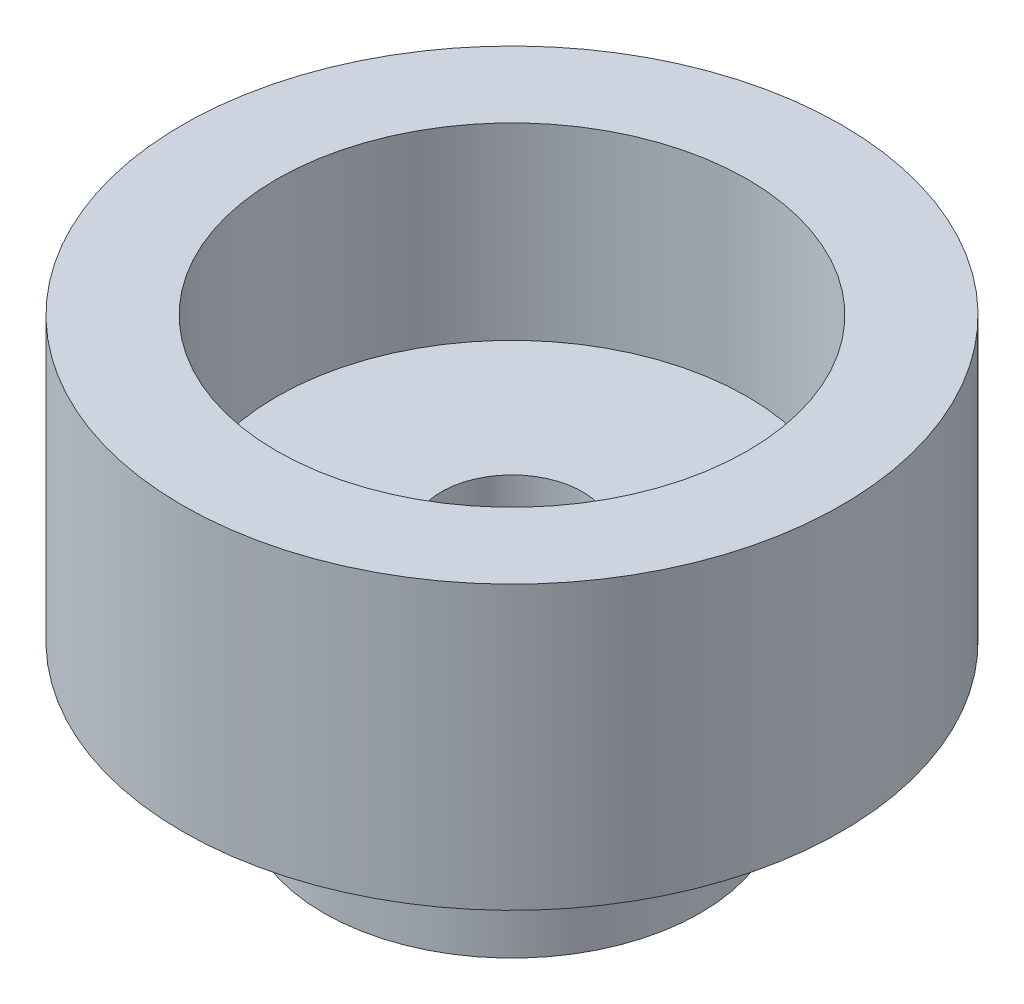
from build123d import *

# Parameters (mm, degrees)
SKETCH1_R           = 1.5
SKETCH1_R_2         = 0.75
BOSS_EXTRUDE1_DEPTH = 2.5
SKETCH2_R           = 3.5
SKETCH2_R_2         = 2.5
BOSS_EXTRUDE2_DEPTH = 2
BOSS_EXTRUDE3_START = 1
SKETCH3_R           = 3.5
SKETCH3_R_2         = 0.75
BOSS_EXTRUDE3_DEPTH = 1
SKETCH4_R           = 2
SKETCH4_R_2         = 0.75
BOSS_EXTRUDE4_DEPTH = 2


with BuildPart() as part:
    # Sketch1 → Boss-Extrude1 (new body)
    with BuildSketch(Plane(origin=(0, 0, 0), x_dir=(1, 0, 0), z_dir=(0, 1, 0))):
        with Locations(Location((0, 0, 0), (0, 0, 270))):
            Circle(SKETCH1_R)
        with Locations(Location((0, 0, 0), (0, 0, 270))):
            Circle(SKETCH1_R_2, mode=Mode.SUBTRACT)
    extrude(amount=BOSS_EXTRUDE1_DEPTH)



with BuildPart() as body_2:
    # Sketch2 → Boss-Extrude2 (new body)
    with BuildSketch(Plane(origin=(0, 2.5, 0), x_dir=(1, 0, 0), z_dir=(0, 1, 0))):
        with Locations(Location((0, 0, 0), (0, 0, 270))):
            Circle(SKETCH2_R)
        with Locations(Location((0, 0, 0), (0, 0, 270))):
            Circle(SKETCH2_R_2, mode=Mode.SUBTRACT)
    extrude(amount=BOSS_EXTRUDE2_DEPTH)


with BuildPart() as part_1:
    add(part.part)

    add(body_2.part)  # Boss-Extrude3 merges body 2
    # Sketch3 → Boss-Extrude3 (add)
    with BuildSketch(Plane(origin=(0, 2.5, 0), x_dir=(-1, 0, 0), z_dir=(0, -1, 0)).offset(BOSS_EXTRUDE3_START)):
        with Locations(Location((0, 0, 0), (0, 0, 270))):
            Circle(SKETCH3_R)
        with Locations(Location((0, 0, 0), (0, 0, 270))):
            Circle(SKETCH3_R_2, mode=Mode.SUBTRACT)
    extrude(amount=-BOSS_EXTRUDE3_DEPTH)

    # Sketch4 → Boss-Extrude4 (add)
    with BuildSketch(Plane(origin=(0, 0, 0), x_dir=(-1, 0, 0), z_dir=(0, -1, 0))):
        with Locations(Location((0, 0, 0), (0, 0, 90))):
            Circle(SKETCH4_R)
        with Locations(Location((0, 0, 0), (0, 0, 270))):
            Circle(SKETCH4_R_2, mode=Mode.SUBTRACT)
    extrude(amount=-BOSS_EXTRUDE4_DEPTH)


solid = part_1.part
